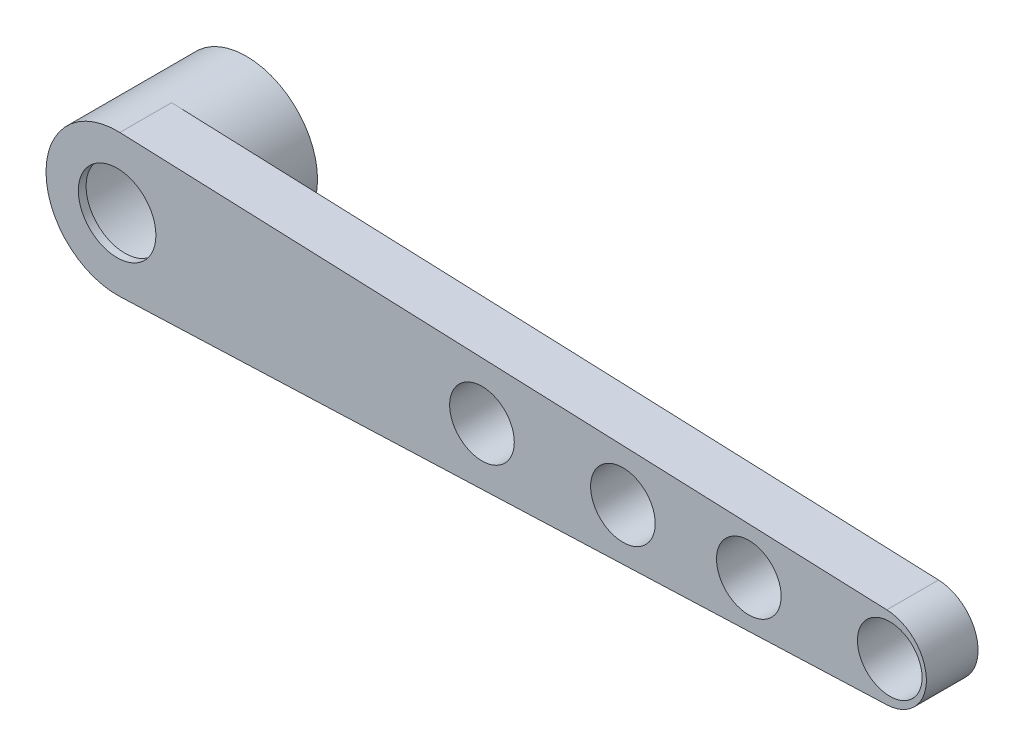
from build123d import *

# Parameters (mm, degrees)
SKETCH_1_R          = 2.75
EXTRUDE_1_DEPTH     = 5
SKETCH_2_R          = 2.5
CUT_EXTRUDE_1_DEPTH = 4.7
SKETCH_3_R          = 1.5
CUT_EXTRUDE_2_DEPTH = 4.7
EXTRUDE_START       = -2
SKETCH_4_R          = 1.25
EXTRUDE_3_DEPTH     = 2
SKETCH_5_R          = 1.25
CUT_EXTRUDE_3_DEPTH = 10


with BuildPart() as part:
    # 草图1 → 凸台-拉伸1 (new body)
    with BuildSketch(Plane.XY):
        Circle(SKETCH_1_R)
    extrude(amount=EXTRUDE_1_DEPTH)

    # 草图2 → 切除-拉伸1 (cut)
    with BuildSketch(Plane(origin=(0, 0, 0), x_dir=(-1, 0, 0), z_dir=(0, 0, -1))):
        Circle(SKETCH_2_R)
    extrude(amount=-CUT_EXTRUDE_1_DEPTH, mode=Mode.SUBTRACT)

    # 草图3 → 切除-拉伸2 (cut)
    with BuildSketch(Plane.XY.offset(5)):
        Circle(SKETCH_3_R)
    extrude(amount=-CUT_EXTRUDE_2_DEPTH, mode=Mode.SUBTRACT)

    # 草图4 → 凸台-拉伸3 (add)
    with BuildSketch(Plane.XY.offset(5).offset(EXTRUDE_START)):
        with BuildLine():
            Line((29.765180985, 1.590978823), (0.10719348, 2.747910035))
            ThreePointArc((0.10719348, 2.747910035), (1.982079977, 1.906268335), (2.75, 0))
            ThreePointArc((2.75, 0), (1.982079977, -1.906268335), (0.10719348, -2.747910035))
            Line((0.10719348, -2.747910035), (29.765180985, -1.590978823))
            ThreePointArc((29.765180985, -1.590978823), (31.29530721, 0), (29.765180985, 1.590978823))
        make_face()
        with Locations((14.11, 0)):
            Circle(SKETCH_4_R, mode=Mode.SUBTRACT)
        with Locations((24.43, 0)):
            Circle(SKETCH_4_R, mode=Mode.SUBTRACT)
        with Locations((29.8799998, 0.003455751)):
            Circle(SKETCH_4_R, mode=Mode.SUBTRACT)
    extrude(amount=EXTRUDE_3_DEPTH)

    # 草图5 → 切除-拉伸3 (cut)
    with BuildSketch(Plane.XY.offset(5)):
        with Locations((19.56, 0)):
            Circle(SKETCH_5_R)
    extrude(amount=-CUT_EXTRUDE_3_DEPTH, mode=Mode.SUBTRACT)


solid = part.part
